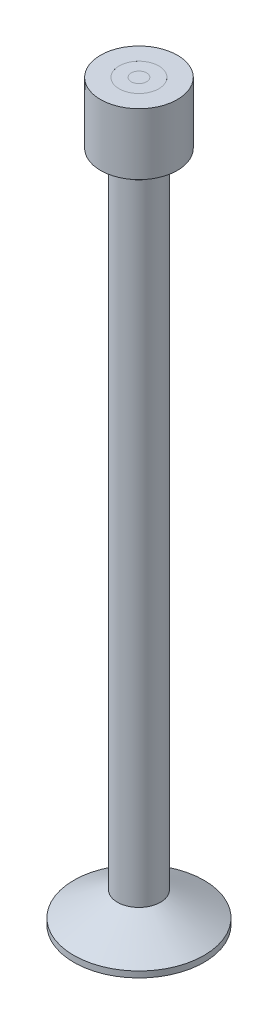
from build123d import *


with BuildPart() as part:
    # Croquis1 → Revolución1 (revolve)
    with BuildSketch(Plane.XY, mode=Mode.PRIVATE) as revoluci_n1_sk:
        Polygon((5.375, 0), (5.375, 0.5), (1.78, 2.5), (1.78, 54.5), (3.171785891, 55.5), (3.171785891, 60.571), (1.635, 60.571), (1.375, 54.942193309), (1.375, 0), align=None)
        Polygon((0.375, 0), (0.375, 54.942193309), (0.635, 60.571), (0.442390715, 60.571), (0, 60.571), (0, 0), align=None)
    revolve(revoluci_n1_sk.sketch.rotate(Axis((0, 60.571, 0), (0, -1, 0)), 180), axis=Axis((0, 60.571, 0), (0, -1, 0)))


with BuildPart() as body_2:
    # Croquis3 → Revolución2 (revolve)
    with BuildSketch(Plane.XY, mode=Mode.PRIVATE) as revoluci_n2_sk:
        Polygon((0.375, 54.942193309), (0.635, 60.571), (1.635, 60.571), (1.375, 54.942193309), (1.375, 0), (0.375, 0), align=None)
    revolve(revoluci_n2_sk.sketch.rotate(Axis((0, 55.5, 0), (0, -1, 0)), 90), axis=Axis((0, 55.5, 0), (0, -1, 0)))


solid = Compound([part.part, body_2.part])
